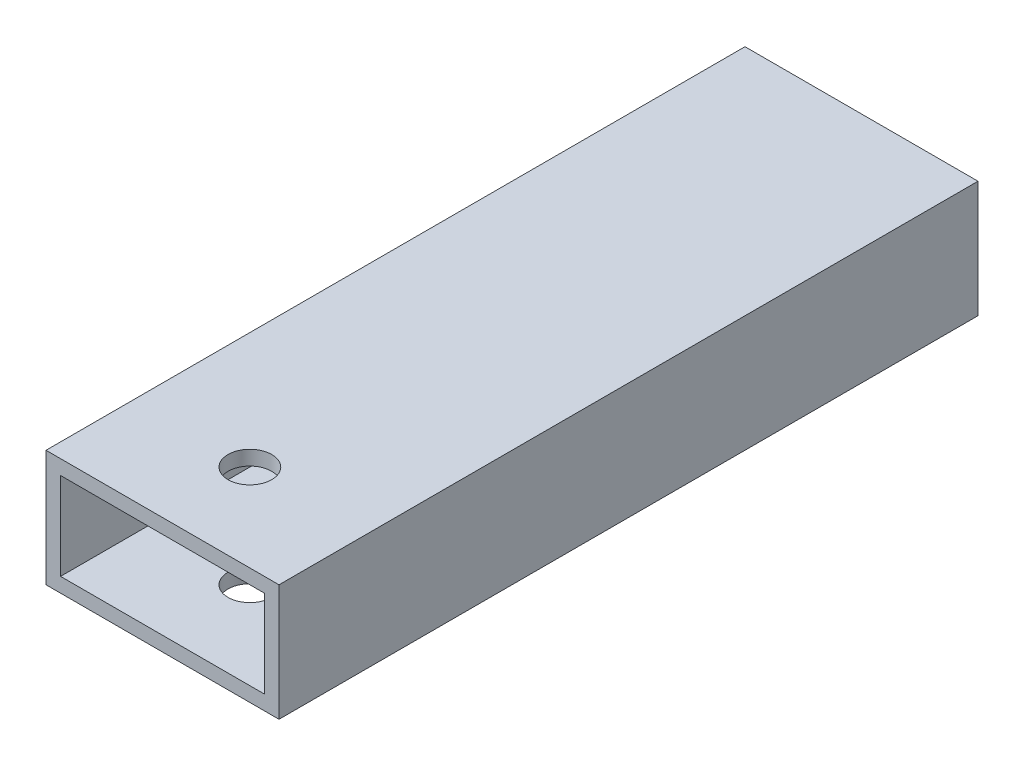
from build123d import *

# Parameters (mm, degrees)
SKETCH1_W           = 50.8
SKETCH1_H           = 25.4
SKETCH1_W_2         = 44.45
SKETCH1_H_2         = 19.05
BOSS_EXTRUDE1_DEPTH = 152.4
SKETCH2_R           = 4.7625
CUT_EXTRUDE1_DEPTH  = 157.576115675


with BuildPart() as part:
    # Sketch1 → Boss-Extrude1 (new body)
    with BuildSketch(Plane.XY):
        Rectangle(SKETCH1_W, SKETCH1_H)
        Rectangle(SKETCH1_W_2, SKETCH1_H_2, mode=Mode.SUBTRACT)
    extrude(amount=BOSS_EXTRUDE1_DEPTH)

    # Sketch2 → Cut-Extrude1 (cut, through all)
    with BuildSketch(Plane(origin=(0, 12.7, 0), x_dir=(1, 0, 0), z_dir=(0, 1, 0))):
        with Locations(Location((0, -133.35, 0), (0, 0, 270))):
            Circle(SKETCH2_R)
    extrude(amount=-CUT_EXTRUDE1_DEPTH, mode=Mode.SUBTRACT)


solid = part.part
